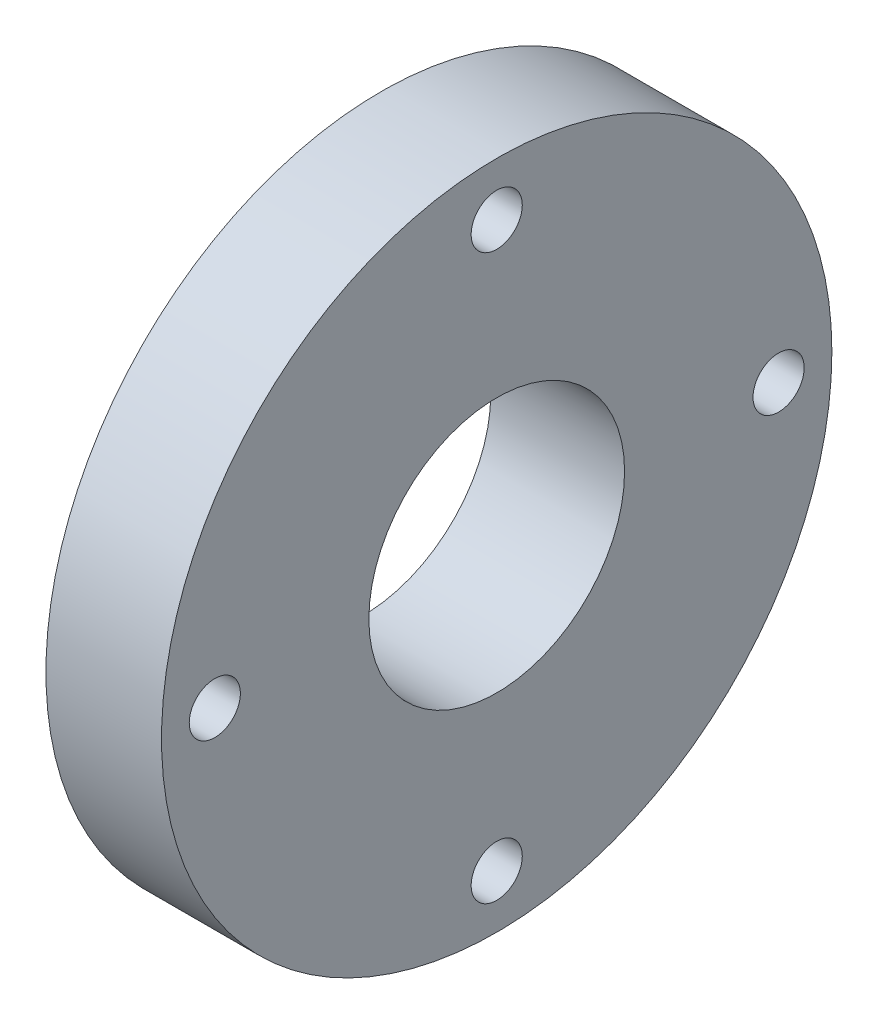
from build123d import *

# Parameters (mm, degrees)
SKETCH1_R             = 32.766
BOSS_EXTRUDE1_DEPTH   = 11.303
SKETCH2_R             = 22.479
BOSS_EXTRUDE2_DEPTH   = 1.778
SKETCH3_R             = 12.5
CUT_EXTRUDE1_DEPTH    = 49.149081746
M6_TAPPED_HOLE1_D     = 5
M6_TAPPED_HOLE1_DEPTH = 12.446
M6_TAPPED_HOLE1_TIP   = 1.502151548


with BuildPart() as part:
    # Sketch1 → Boss-Extrude1 (new body)
    with BuildSketch(Plane(origin=(0, 0, 0), x_dir=(0, 0, -1), z_dir=(1, 0, 0))):
        Circle(SKETCH1_R)
    extrude(amount=-BOSS_EXTRUDE1_DEPTH)

    # Sketch2 → Boss-Extrude2 (add)
    with BuildSketch(Plane.ZY.offset(11.303)):
        with Locations(Location((0, 0, 0), (0, 0, 180))):
            Circle(SKETCH2_R)
    extrude(amount=BOSS_EXTRUDE2_DEPTH)

    # Sketch3 → Cut-Extrude1 (cut, through all)
    with BuildSketch(Plane.ZY.offset(13.081)):
        Circle(SKETCH3_R)
    extrude(amount=-CUT_EXTRUDE1_DEPTH, mode=Mode.SUBTRACT)

    # M6 Tapped Hole1
    with Locations(Plane.ZY.offset(11.303)):
        with Locations((0, 27.559), (27.559, 0), (0, -27.559), (-27.559, 0)):
            Hole(M6_TAPPED_HOLE1_D / 2, depth=M6_TAPPED_HOLE1_DEPTH)
            with Locations((0, 0, -(M6_TAPPED_HOLE1_DEPTH + M6_TAPPED_HOLE1_TIP / 2))):  # 118° drill point
                Cone(0, M6_TAPPED_HOLE1_D / 2, M6_TAPPED_HOLE1_TIP, mode=Mode.SUBTRACT)


solid = part.part
